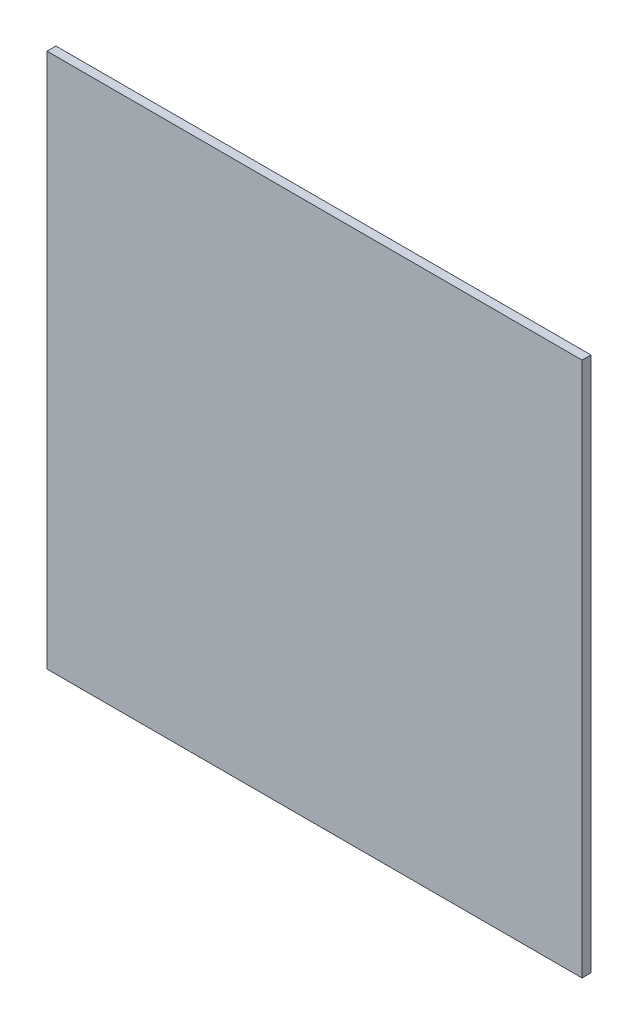
from build123d import *

# Parameters (mm, degrees)
ESQUISSE1_W        = 300
ESQUISSE1_H        = 300
BOSS_EXTRU_1_DEPTH = 5


with BuildPart() as part:
    # Esquisse1 → Boss.-Extru.1 (new body)
    with BuildSketch(Plane.XY):
        Rectangle(ESQUISSE1_W, ESQUISSE1_H)
    extrude(amount=BOSS_EXTRU_1_DEPTH)


solid = part.part
